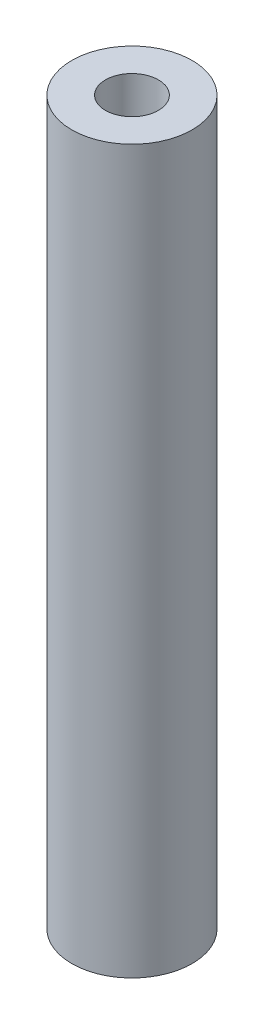
from build123d import *

# Parameters (mm, degrees)
SKETCH_1_R      = 5
SKETCH_1_R_2    = 2.2
EXTRUDE_1_DEPTH = 60


with BuildPart() as part:
    # 草图1 → 凸台-拉伸1 (new body)
    with BuildSketch(Plane(origin=(0, 0, 0), x_dir=(1, 0, 0), z_dir=(0, 1, 0))):
        with Locations(Location((0, 0, 0), (0, 0, 270))):
            Circle(SKETCH_1_R)
        with Locations(Location((0, 0, 0), (0, 0, 270))):
            Circle(SKETCH_1_R_2, mode=Mode.SUBTRACT)
    extrude(amount=EXTRUDE_1_DEPTH)


solid = part.part
